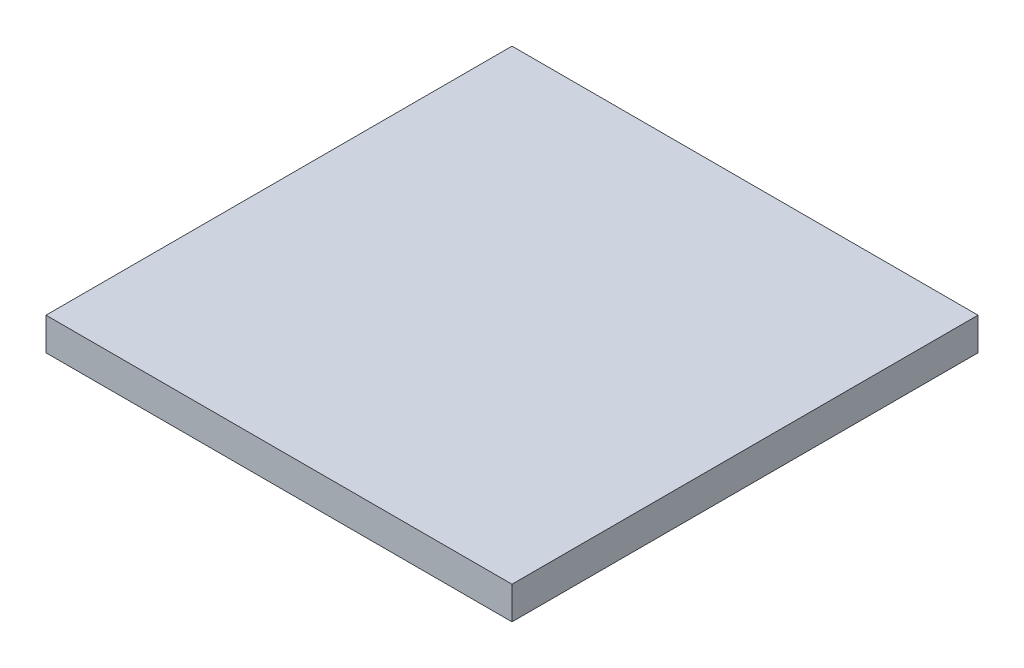
from build123d import *

# Parameters (mm, degrees)
SKETCH1_W           = 127
SKETCH1_H           = 127
BOSS_EXTRUDE1_DEPTH = 15.24
SKETCH2_W           = 127
SKETCH2_H           = 127
SKETCH2_W_2         = 100.33
SKETCH2_H_2         = 100.33
CUT_EXTRUDE1_DEPTH  = 6.35


with BuildPart() as part:
    # Sketch1 → Boss-Extrude1 (new body)
    with BuildSketch(Plane(origin=(0, 0, 0), x_dir=(1, 0, 0), z_dir=(0, 1, 0))):
        Rectangle(SKETCH1_W, SKETCH1_H)
    extrude(amount=BOSS_EXTRUDE1_DEPTH)

    # Sketch2 → Cut-Extrude1 (cut)
    with BuildSketch(Plane.XZ):
        Rectangle(SKETCH2_W, SKETCH2_H)
        Rectangle(SKETCH2_W_2, SKETCH2_H_2, mode=Mode.SUBTRACT)
    extrude(amount=-CUT_EXTRUDE1_DEPTH, mode=Mode.SUBTRACT)


solid = part.part
